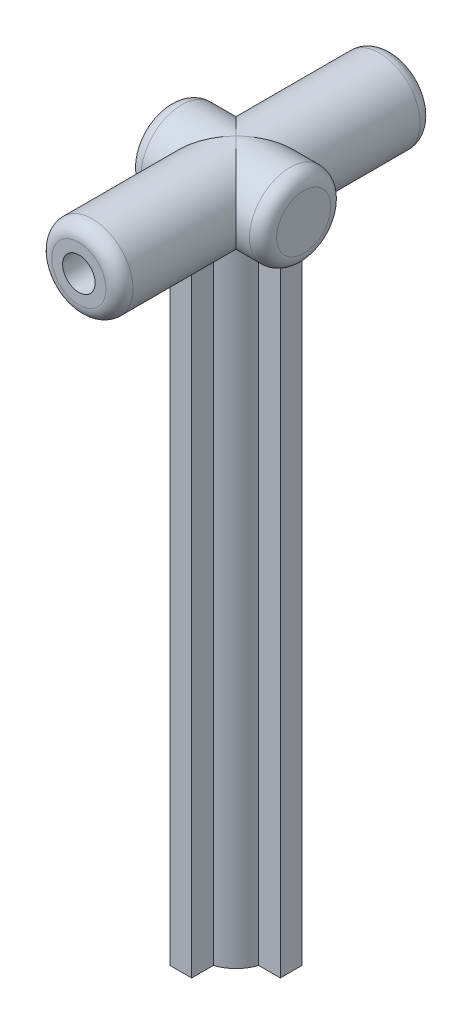
from build123d import *

# Parameters (mm, degrees)
BOSS_EXTRUDE2_DEPTH      = 58.42
SKETCH4_R                = 1.905
CUT_EXTRUDE1_DEPTH       = 59.876420978
BOSS_EXTRUDE3_DEPTH      = 14.732
BOSS_EXTRUDE3_DEPTH_BACK = 14.732
SKETCH5_R                = 3.81
SKETCH6_R                = 3.738220815
CUT_EXTRUDE3_DEPTH       = 12.7
BOSS_EXTRUDE4_DEPTH      = 6.35
BOSS_EXTRUDE4_DEPTH_BACK = 6.35
SKETCH7_R                = 3.81
FILLET2_R                = 1.27
FILLET3_R                = 1.27
FILLET4_R                = 1.27
SKETCH8_R                = 1.524
SKETCH8_W                = 1.27
SKETCH8_H                = 0.341676571
CUT_EXTRUDE4_DEPTH       = 7.62


with BuildPart() as part:
    # Sketch3 → Boss-Extrude2 (new body)
    with BuildSketch(Plane(origin=(0, 0, 0), x_dir=(1, 0, 0), z_dir=(0, 1, 0))):
        with BuildLine():
            Line((-1.016, 3.141806487), (-1.016, 5.173806487))
            Line((-1.016, 5.173806487), (1.016, 5.173806487))
            Line((1.016, 5.173806487), (1.016, 3.141806487))
            ThreePointArc((1.016, 3.141806487), (2.334866591, 2.334866591), (3.141806487, 1.016))
            Line((3.141806487, 1.016), (5.173806487, 1.016))
            Line((5.173806487, 1.016), (5.173806487, -1.016))
            Line((5.173806487, -1.016), (3.141806487, -1.016))
            ThreePointArc((3.141806487, -1.016), (2.334866591, -2.334866591), (1.016, -3.141806487))
            Line((1.016, -3.141806487), (1.016, -5.173806487))
            Line((1.016, -5.173806487), (-1.016, -5.173806487))
            Line((-1.016, -5.173806487), (-1.016, -3.141806487))
            ThreePointArc((-1.016, -3.141806487), (-2.334866591, -2.334866591), (-3.141806487, -1.016))
            Line((-3.141806487, -1.016), (-5.173806487, -1.016))
            Line((-5.173806487, -1.016), (-5.173806487, 1.016))
            Line((-5.173806487, 1.016), (-3.141806487, 1.016))
            ThreePointArc((-3.141806487, 1.016), (-2.334866591, 2.334866591), (-1.016, 3.141806487))
        make_face()
    extrude(amount=BOSS_EXTRUDE2_DEPTH)

    # Sketch4 → Cut-Extrude1 (cut, through all)
    with BuildSketch(Plane(origin=(0, 58.42, 0), x_dir=(1, 0, 0), z_dir=(0, 1, 0))):
        with Locations(Location((0, 0, 0), (0, 0, 270))):
            Circle(SKETCH4_R)
    extrude(amount=-CUT_EXTRUDE1_DEPTH, mode=Mode.SUBTRACT)


with BuildPart() as body_2:
    # Sketch5 → Boss-Extrude3 (new, two sides: drawn at the far end of the back side and taken through both)
    with BuildSketch(Plane.XY.offset(-BOSS_EXTRUDE3_DEPTH_BACK)):
        with Locations((0, 61.468)):
            Circle(SKETCH5_R)
    extrude(amount=BOSS_EXTRUDE3_DEPTH + BOSS_EXTRUDE3_DEPTH_BACK)


with BuildPart() as body_3:
    # Mirror1: mirrored copy
    add(body_2.part.mirror(Plane.XY))


with BuildPart() as cut_extrude3_tool:
    # Sketch6 → Cut-Extrude3 (new body)
    with BuildSketch(Plane.XY.offset(14.732)):
        with Locations((0, 61.468)):
            Circle(SKETCH6_R)
    extrude(amount=-CUT_EXTRUDE3_DEPTH)


with BuildPart() as body_2_1:
    add(body_2.part)

    # Cut-Extrude3: cut by cut_extrude3_tool
    add(cut_extrude3_tool.part, mode=Mode.SUBTRACT)


with BuildPart() as body_3_1:
    add(body_3.part)

    # Cut-Extrude3: cut by cut_extrude3_tool
    add(cut_extrude3_tool.part, mode=Mode.SUBTRACT)


with BuildPart() as body_4:
    # Mirror2: mirrored copy
    add(body_2_1.part.mirror(Plane.XY))


with BuildPart() as body_2_2:
    add(body_2_1.part)

    add(body_3_1.part)  # Boss-Extrude4 merges body 3

    add(body_4.part)  # Boss-Extrude4 merges body 4
    # Sketch7 → Boss-Extrude4 (add, two sides: drawn at the far end of the back side and taken through both)
    with BuildSketch(Plane(origin=(0, 0, 0), x_dir=(0, 0, -1), z_dir=(1, 0, 0)).offset(-BOSS_EXTRUDE4_DEPTH_BACK)):
        with Locations((0, 61.468)):
            Circle(SKETCH7_R)
    extrude(amount=BOSS_EXTRUDE4_DEPTH + BOSS_EXTRUDE4_DEPTH_BACK)

    # Fillet2
    fillet2_edges = [body_2_2.edges().sort_by_distance(p)[0] for p in [
        (-3.81, 61.468, -14.732),
    ]]
    fillet(fillet2_edges, radius=FILLET2_R)

    # Fillet3
    fillet3_edges = [body_2_2.edges().sort_by_distance(p)[0] for p in [
        (-6.35, 61.468, 3.81),
        (6.35, 61.468, 3.81),
    ]]
    fillet(fillet3_edges, radius=FILLET3_R)

    # Fillet4
    fillet4_edges = [body_2_2.edges().sort_by_distance(p)[0] for p in [
        (-3.81, 61.468, 14.732),
    ]]
    fillet(fillet4_edges, radius=FILLET4_R)

    # Sketch8 → Cut-Extrude4 (cut)
    with BuildSketch(Plane.XY.offset(14.732)):
        with Locations((0, 61.468)):
            Circle(SKETCH8_R)
        with Locations((0, 57.540451053)):
            Rectangle(SKETCH8_W, SKETCH8_H)
    cut_extrude4 = extrude(amount=-CUT_EXTRUDE4_DEPTH, mode=Mode.SUBTRACT)

    # Mirror3: Cut-Extrude4 across plane
    add(cut_extrude4.mirror(Plane.XY), mode=Mode.SUBTRACT)


solid = Compound([part.part, body_2_2.part])
